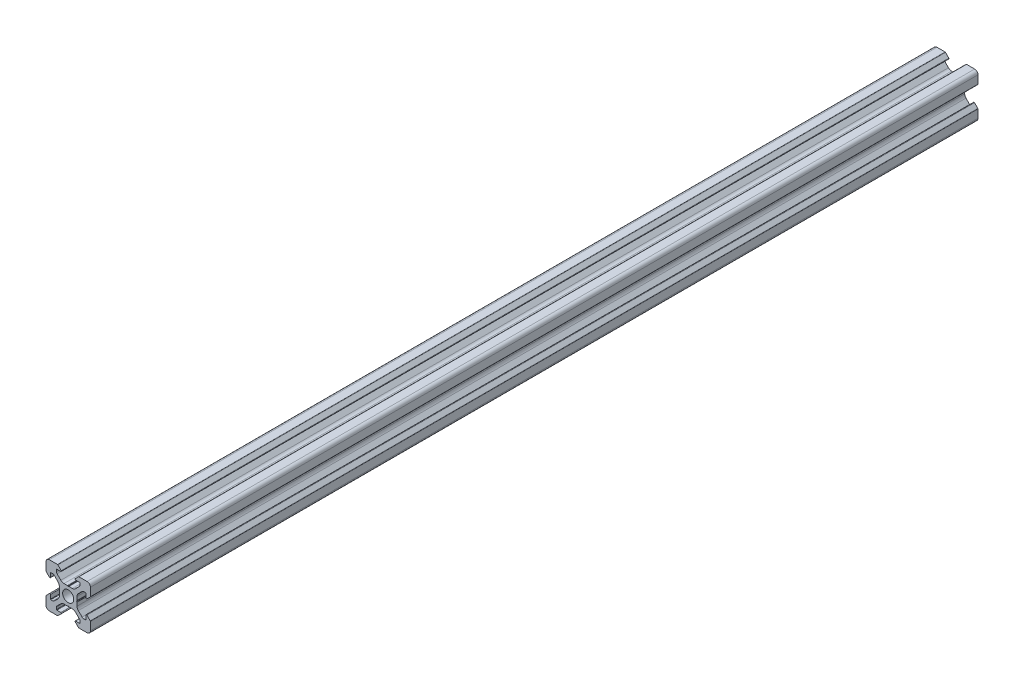
from build123d import *

# Parameters (mm, degrees)
MODEL_R         = 2.5
EXTRUDE_1_DEPTH = 400


with BuildPart() as part:
    # Model → Бобышка-Вытянуть1 (new body)
    with BuildSketch(Plane.XY):
        with BuildLine():
            Line((-4, 0.337695265), (-4, 1.898780669))
            ThreePointArc((-4, 1.898780669), (-4.152240935, 2.664147534), (-4.585786438, 3.312994231))
            Line((-4.585786438, 3.312994231), (-6.279898987, 5.007106781))
            ThreePointArc((-6.279898987, 5.007106781), (-6.604322336, 5.223879533), (-6.987005769, 5.3))
            Line((-6.987005769, 5.3), (-7.8, 5.3))
            ThreePointArc((-7.8, 5.3), (-7.941421356, 5.241421356), (-8, 5.1))
            Line((-8, 5.1), (-8, 3.33))
            ThreePointArc((-8, 3.33), (-8.154329142, 3.099030117), (-8.426776695, 3.153223305))
            Line((-8.426776695, 3.153223305), (-9.926776695, 4.653223305))
            ThreePointArc((-9.926776695, 4.653223305), (-9.980969883, 4.734329142), (-10, 4.83))
            Line((-10, 4.83), (-10, 8.5))
            ThreePointArc((-10, 8.5), (-9.560660172, 9.560660172), (-8.5, 10))
            Line((-8.5, 10), (-4.83, 10))
            ThreePointArc((-4.83, 10), (-4.734329142, 9.980969883), (-4.653223305, 9.926776695))
            Line((-4.653223305, 9.926776695), (-3.153223305, 8.426776695))
            ThreePointArc((-3.153223305, 8.426776695), (-3.099030117, 8.154329142), (-3.33, 8))
            Line((-3.33, 8), (-5.1, 8))
            ThreePointArc((-5.1, 8), (-5.241421356, 7.941421356), (-5.3, 7.8))
            Line((-5.3, 7.8), (-5.3, 6.987005769))
            ThreePointArc((-5.3, 6.987005769), (-5.223879533, 6.604322336), (-5.007106781, 6.279898987))
            Line((-5.007106781, 6.279898987), (-3.312994231, 4.585786438))
            ThreePointArc((-3.312994231, 4.585786438), (-2.664147534, 4.152240935), (-1.898780669, 4))
            Line((-1.898780669, 4), (-0.337695265, 4))
            ThreePointArc((-0.337695265, 4), (-0.254943529, 3.98590708), (-0.181521503, 3.945217202))
            Line((-0.181521503, 3.945217202), (0, 3.8))
            Line((0, 3.8), (0.181521503, 3.945217202))
            ThreePointArc((0.181521503, 3.945217202), (0.254943529, 3.98590708), (0.337695265, 4))
            Line((0.337695265, 4), (1.898780669, 4))
            ThreePointArc((1.898780669, 4), (2.664147534, 4.152240935), (3.312994231, 4.585786438))
            Line((3.312994231, 4.585786438), (5.007106781, 6.279898987))
            ThreePointArc((5.007106781, 6.279898987), (5.223879533, 6.604322336), (5.3, 6.987005769))
            Line((5.3, 6.987005769), (5.3, 7.8))
            ThreePointArc((5.3, 7.8), (5.241421356, 7.941421356), (5.1, 8))
            Line((5.1, 8), (3.33, 8))
            ThreePointArc((3.33, 8), (3.099030117, 8.154329142), (3.153223305, 8.426776695))
            Line((3.153223305, 8.426776695), (4.653223305, 9.926776695))
            ThreePointArc((4.653223305, 9.926776695), (4.734329142, 9.980969883), (4.83, 10))
            Line((4.83, 10), (8.5, 10))
            ThreePointArc((8.5, 10), (9.560660172, 9.560660172), (10, 8.5))
            Line((10, 8.5), (10, 4.83))
            ThreePointArc((10, 4.83), (9.980969883, 4.734329142), (9.926776695, 4.653223305))
            Line((9.926776695, 4.653223305), (8.426776695, 3.153223305))
            ThreePointArc((8.426776695, 3.153223305), (8.154329142, 3.099030117), (8, 3.33))
            Line((8, 3.33), (8, 5.1))
            ThreePointArc((8, 5.1), (7.941421356, 5.241421356), (7.8, 5.3))
            Line((7.8, 5.3), (6.987005769, 5.3))
            ThreePointArc((6.987005769, 5.3), (6.604322336, 5.223879533), (6.279898987, 5.007106781))
            Line((6.279898987, 5.007106781), (4.585786438, 3.312994231))
            ThreePointArc((4.585786438, 3.312994231), (4.152240935, 2.664147534), (4, 1.898780669))
            Line((4, 1.898780669), (4, 0.337695265))
            ThreePointArc((4, 0.337695265), (3.98590708, 0.254943529), (3.945217202, 0.181521503))
            Line((3.945217202, 0.181521503), (3.8, 0))
            Line((3.8, 0), (3.945217202, -0.181521503))
            ThreePointArc((3.945217202, -0.181521503), (3.98590708, -0.254943529), (4, -0.337695265))
            Line((4, -0.337695265), (4, -1.898780669))
            ThreePointArc((4, -1.898780669), (4.152240935, -2.664147534), (4.585786438, -3.312994231))
            Line((4.585786438, -3.312994231), (6.279898987, -5.007106781))
            ThreePointArc((6.279898987, -5.007106781), (6.604322336, -5.223879533), (6.987005769, -5.3))
            Line((6.987005769, -5.3), (7.8, -5.3))
            ThreePointArc((7.8, -5.3), (7.941421356, -5.241421356), (8, -5.1))
            Line((8, -5.1), (8, -3.33))
            ThreePointArc((8, -3.33), (8.154329142, -3.099030117), (8.426776695, -3.153223305))
            Line((8.426776695, -3.153223305), (9.926776695, -4.653223305))
            ThreePointArc((9.926776695, -4.653223305), (9.980969883, -4.734329142), (10, -4.83))
            Line((10, -4.83), (10, -8.5))
            ThreePointArc((10, -8.5), (9.560660172, -9.560660172), (8.5, -10))
            Line((8.5, -10), (4.83, -10))
            ThreePointArc((4.83, -10), (4.734329142, -9.980969883), (4.653223305, -9.926776695))
            Line((4.653223305, -9.926776695), (3.153223305, -8.426776695))
            ThreePointArc((3.153223305, -8.426776695), (3.099030117, -8.154329142), (3.33, -8))
            Line((3.33, -8), (5.1, -8))
            ThreePointArc((5.1, -8), (5.241421356, -7.941421356), (5.3, -7.8))
            Line((5.3, -7.8), (5.3, -6.987005769))
            ThreePointArc((5.3, -6.987005769), (5.223879533, -6.604322336), (5.007106781, -6.279898987))
            Line((5.007106781, -6.279898987), (3.312994231, -4.585786438))
            ThreePointArc((3.312994231, -4.585786438), (2.664147534, -4.152240935), (1.898780669, -4))
            Line((1.898780669, -4), (0.337695265, -4))
            ThreePointArc((0.337695265, -4), (0.254943529, -3.98590708), (0.181521503, -3.945217202))
            Line((0.181521503, -3.945217202), (0, -3.8))
            Line((0, -3.8), (-0.181521503, -3.945217202))
            ThreePointArc((-0.181521503, -3.945217202), (-0.254943529, -3.98590708), (-0.337695265, -4))
            Line((-0.337695265, -4), (-1.898780669, -4))
            ThreePointArc((-1.898780669, -4), (-2.664147534, -4.152240935), (-3.312994231, -4.585786438))
            Line((-3.312994231, -4.585786438), (-5.007106781, -6.279898987))
            ThreePointArc((-5.007106781, -6.279898987), (-5.223879533, -6.604322336), (-5.3, -6.987005769))
            Line((-5.3, -6.987005769), (-5.3, -7.8))
            ThreePointArc((-5.3, -7.8), (-5.241421356, -7.941421356), (-5.1, -8))
            Line((-5.1, -8), (-3.33, -8))
            ThreePointArc((-3.33, -8), (-3.099030117, -8.154329142), (-3.153223305, -8.426776695))
            Line((-3.153223305, -8.426776695), (-4.653223305, -9.926776695))
            ThreePointArc((-4.653223305, -9.926776695), (-4.734329142, -9.980969883), (-4.83, -10))
            Line((-4.83, -10), (-8.5, -10))
            ThreePointArc((-8.5, -10), (-9.560660172, -9.560660172), (-10, -8.5))
            Line((-10, -8.5), (-10, -4.83))
            ThreePointArc((-10, -4.83), (-9.980969883, -4.734329142), (-9.926776695, -4.653223305))
            Line((-9.926776695, -4.653223305), (-8.426776695, -3.153223305))
            ThreePointArc((-8.426776695, -3.153223305), (-8.154329142, -3.099030117), (-8, -3.33))
            Line((-8, -3.33), (-8, -5.1))
            ThreePointArc((-8, -5.1), (-7.941421356, -5.241421356), (-7.8, -5.3))
            Line((-7.8, -5.3), (-6.987005769, -5.3))
            ThreePointArc((-6.987005769, -5.3), (-6.604322336, -5.223879533), (-6.279898987, -5.007106781))
            Line((-6.279898987, -5.007106781), (-4.585786438, -3.312994231))
            ThreePointArc((-4.585786438, -3.312994231), (-4.152240935, -2.664147534), (-4, -1.898780669))
            Line((-4, -1.898780669), (-4, -0.337695265))
            ThreePointArc((-4, -0.337695265), (-3.98590708, -0.254943529), (-3.945217202, -0.181521503))
            Line((-3.945217202, -0.181521503), (-3.8, 0))
            Line((-3.8, 0), (-3.945217202, 0.181521503))
            ThreePointArc((-3.945217202, 0.181521503), (-3.98590708, 0.254943529), (-4, 0.337695265))
        make_face()
        Circle(MODEL_R, mode=Mode.SUBTRACT)
    extrude(amount=EXTRUDE_1_DEPTH)


solid = part.part
